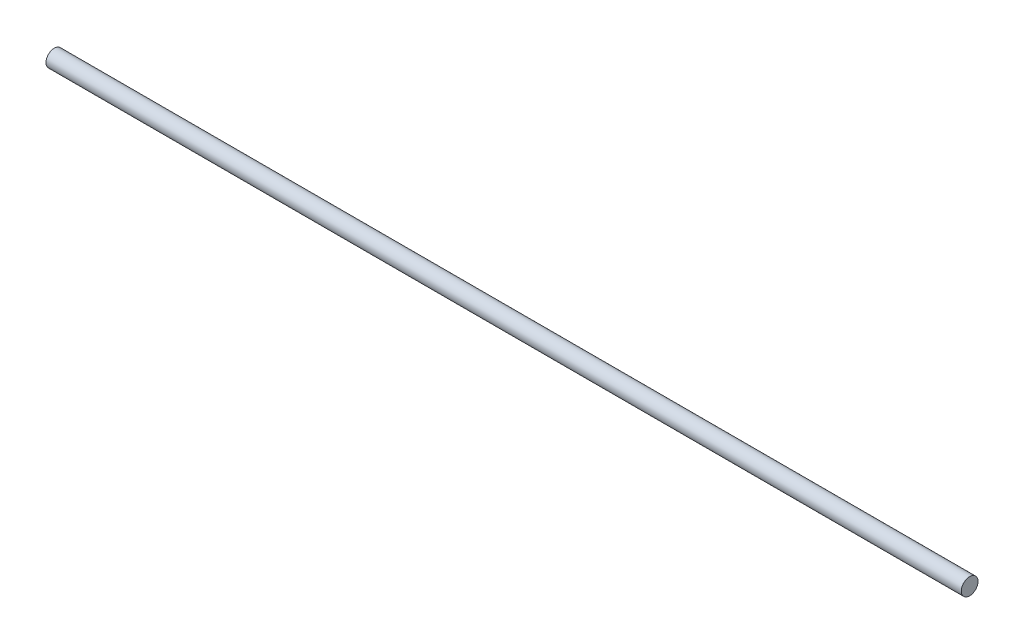
from build123d import *

# Parameters (mm, degrees)
CROQUIS1_R              = 2.5
SALIENTE_EXTRUIR1_DEPTH = 274


with BuildPart() as part:
    # Croquis1 → Saliente-Extruir1 (new body)
    with BuildSketch(Plane(origin=(0, 0, 0), x_dir=(0, 0, -1), z_dir=(1, 0, 0))):
        Circle(CROQUIS1_R)
    extrude(amount=SALIENTE_EXTRUIR1_DEPTH)


solid = part.part
